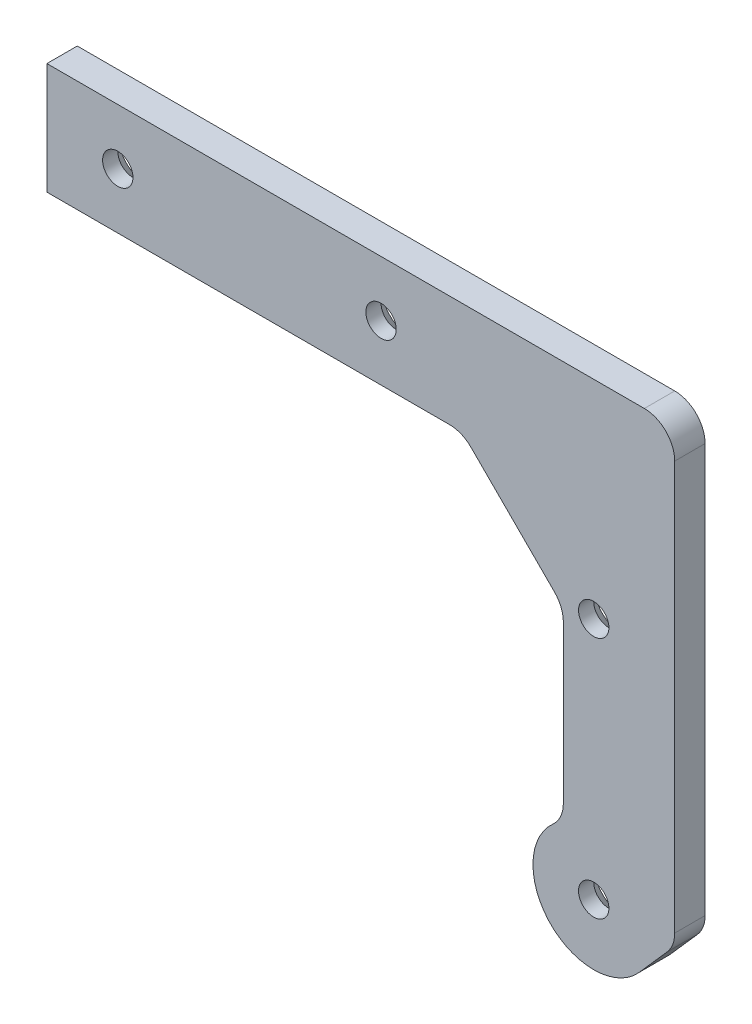
from build123d import *

# Parameters (mm, degrees)
EXTRUDE_598_DEPTH      = 3
SKETCH_656_R           = 1.5
CUT_EXTRUDE_1014_DEPTH = 74.235920149
SKETCH_3_R             = 6
SKETCH_3_R_2           = 1.5
EXTRUDE_1306_DEPTH     = 3
CUT_EXTRUDE_1628_DEPTH = 74.235920149
CHAMFER_3_SIZE         = 10
FILLET_3_R             = 3
CHAMFER_2_SIZE         = 1.5


with BuildPart() as part:
    # Эскиз1 → Extrude 598 (new body)
    with BuildSketch(Plane.XY):
        Polygon((-56.5, 5.5), (-56.5, -5.5), (-5.5, -5.5), (-5.5, -46.5), (5.5, -46.5), (5.5, 5.5), align=None)
    extrude(amount=EXTRUDE_598_DEPTH)

    # Sketch 656 → Cut-Extrude 1014 (cut, through all)
    with BuildSketch(Plane.XY.offset(3)):
        with Locations((-49.5, 0)):
            Circle(SKETCH_656_R)
        with Locations((-23.5, 0)):
            Circle(SKETCH_656_R)
        with Locations((-2.5, -15)):
            Circle(SKETCH_656_R)
        with Locations((-2.5, -39)):
            Circle(SKETCH_656_R)
    extrude(amount=-CUT_EXTRUDE_1014_DEPTH, mode=Mode.SUBTRACT)

    # Эскиз3 → Extrude 1306 (add)
    with BuildSketch(Plane.XY.offset(3)):
        with Locations((-2.5, -39)):
            Circle(SKETCH_3_R)
        with Locations((-2.5, -39)):
            Circle(SKETCH_3_R_2, mode=Mode.SUBTRACT)
    extrude(amount=-EXTRUDE_1306_DEPTH)

    # Эскиз4 → Cut-Extrude 1628 (cut, through all)
    with BuildSketch(Plane.XY.offset(3)):
        with BuildLine():
            Line((-5.5, -46.5), (-5.5, -44.196152423))
            ThreePointArc((-5.5, -44.196152423), (-1.530874267, -44.921215696), (2, -42.968626967))
            Line((2, -42.968626967), (5.5, -39))
            Line((5.5, -39), (5.5, -46.5))
            Line((5.5, -46.5), (-5.5, -46.5))
        make_face()
    extrude(amount=-CUT_EXTRUDE_1628_DEPTH, mode=Mode.SUBTRACT)

    # Фаска3
    chamfer_3_edges = [part.edges().sort_by_distance(p)[0] for p in [
        (-5.5, -5.5, 1.5),
    ]]
    chamfer(chamfer_3_edges, length=CHAMFER_3_SIZE)

    # Скругление3
    fillet_3_edges = [part.edges().sort_by_distance(p)[0] for p in [
        (5.5, 5.5, 1.5),
        (-5.5, -33.803847577, 1.5),
        (5.5, -39, 1.5),
        (-5.5, -15.5, 1.5),
        (-15.5, -5.5, 1.5),
    ]]
    fillet(fillet_3_edges, radius=FILLET_3_R)

    # Фаска2
    chamfer_2_edges = [part.edges().sort_by_distance(p)[0] for p in [
        (-4, -15, 0),
        (-51, 0, 0),
        (-25, 0, 0),
        (-4, -39, 0),
    ]]
    chamfer(chamfer_2_edges, length=CHAMFER_2_SIZE)


solid = part.part
